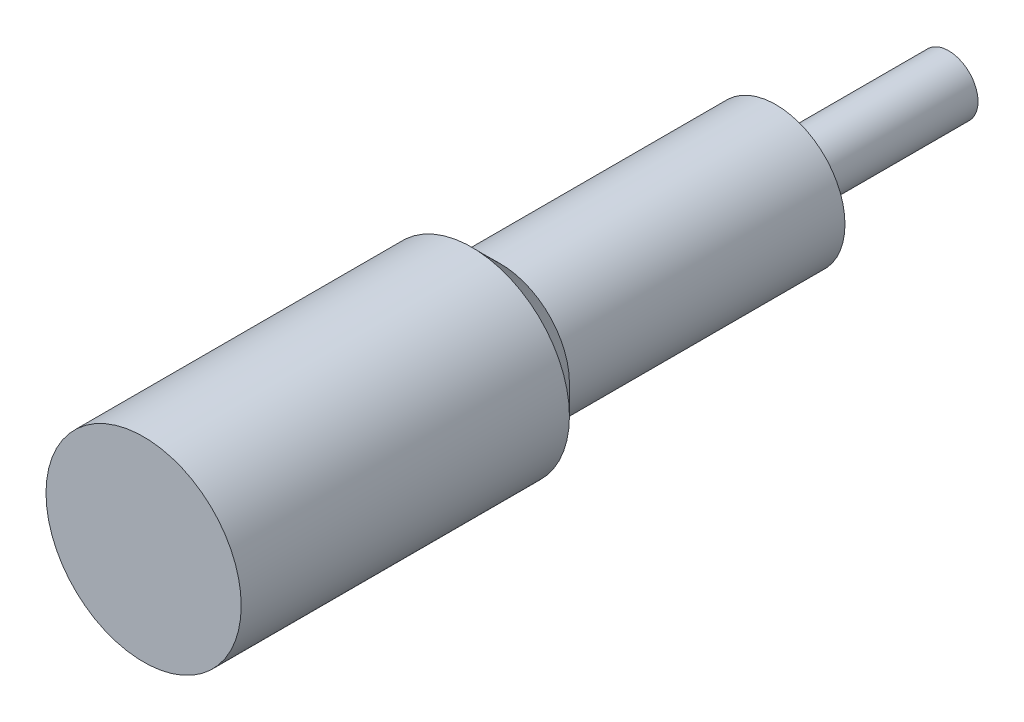
from build123d import *


with BuildPart() as part:
    # Sketch1 → Revolve1 (revolve)
    with BuildSketch(Plane(origin=(0, 0, 0), x_dir=(0, 0, -1), z_dir=(1, 0, 0)), mode=Mode.PRIVATE) as revolve1_sk:
        Polygon((-23.3, 0), (-23.3, 5.65), (-4.3, 5.65), (-2.65, 4), (13.3, 4), (13.3, 1.7), (23.3, 1.7), (23.3, 0), align=None)
    revolve(revolve1_sk.sketch.rotate(Axis((0, 0, 15.044378698), (0, 0, -1)), 90), axis=Axis((0, 0, 15.044378698), (0, 0, -1)))


solid = part.part
